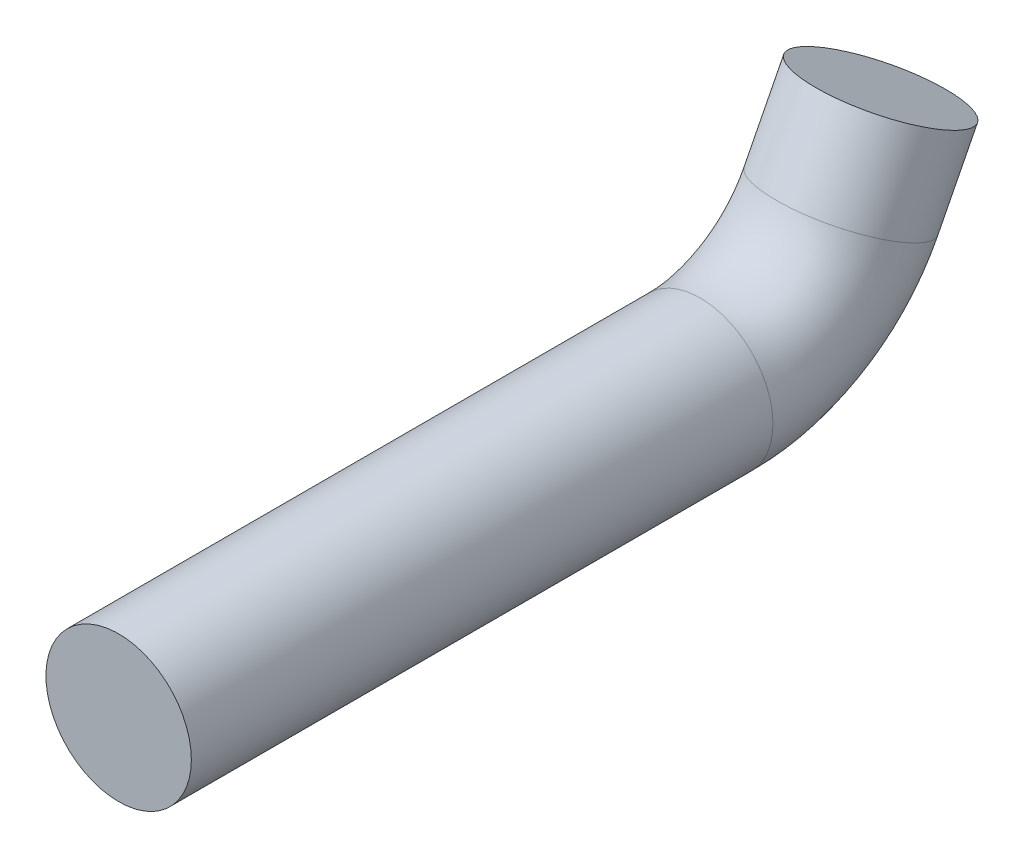
from build123d import *

# Parameters (mm, degrees)
SKETCH1_R           = 1905
BOSS_EXTRUDE1_DEPTH = 15138.4
SKETCH2_R           = 1905
SKETCH4_R           = 1905
BOSS_EXTRUDE2_DEPTH = 2286


with BuildPart() as part:
    # Sketch1 → Boss-Extrude1 (new body)
    with BuildSketch(Plane.XY):
        Circle(SKETCH1_R)
    extrude(amount=BOSS_EXTRUDE1_DEPTH)

    # Sweep1: sweep along a path in Sketch3
    with BuildLine(Plane(origin=(0, 0, 0), x_dir=(0, 0, -1), z_dir=(1, 0, 0))) as sweep1_path:
        Line((0, 0), (101.6, 0))
        ThreePointArc((101.6, 0), (2264.848557637, 610.099191541), (3790.545211445, 2260.588532978))
    # Sketch2 → Sweep1 (sweep)
    with BuildSketch(Plane(origin=(0, 0, 0), x_dir=(-1, 0, 0), z_dir=(0, 0, -1))):
        Circle(SKETCH2_R)
    sweep(path=sweep1_path.line)

    # Sketch4 → Boss-Extrude2 (add)
    with BuildSketch(Plane(origin=(0, 3327.972314085, -1695.686589239), x_dir=(1, 0, 0), z_dir=(0, 0.8910065241883625, -0.45399049973955735))):
        with Locations(Location((0, 2351.114795836, 0), (0, 0, 90))):
            Circle(SKETCH4_R)
    extrude(amount=BOSS_EXTRUDE2_DEPTH)


solid = part.part
